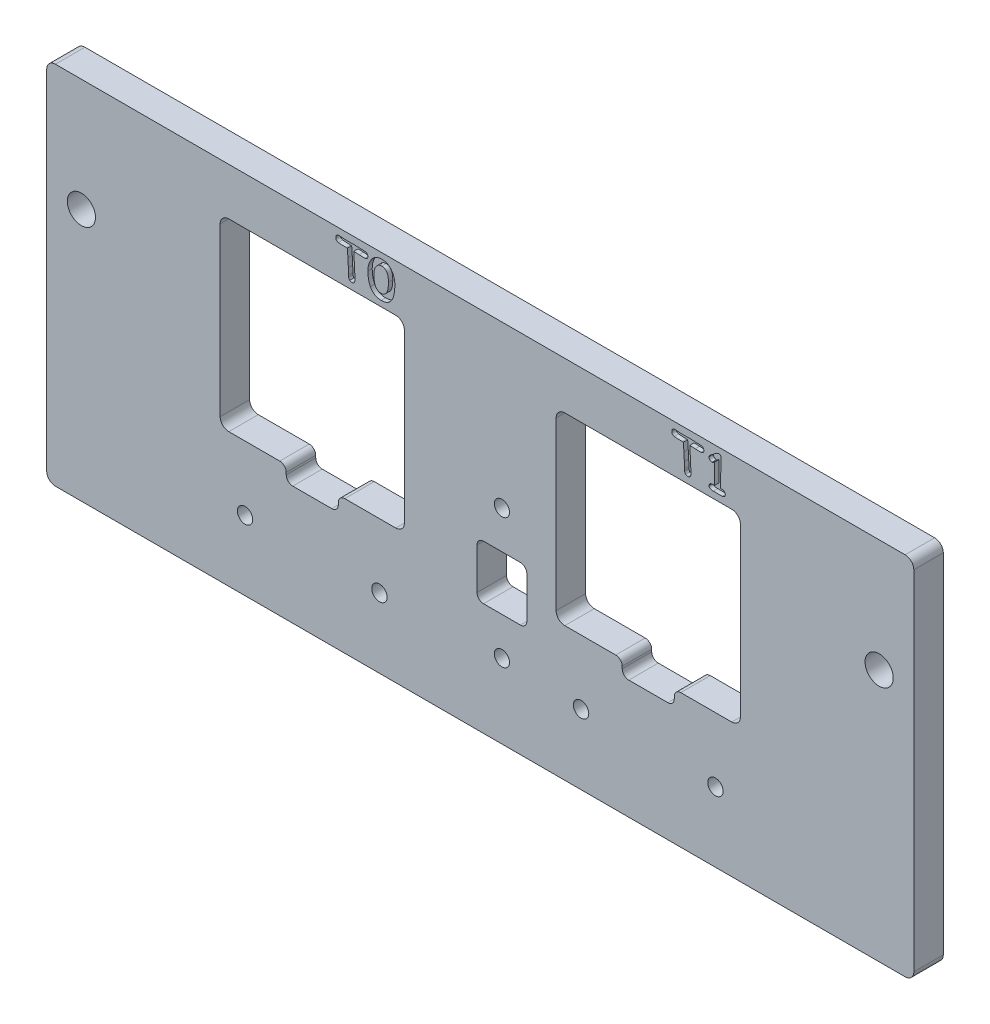
from build123d import *

# Parameters (mm, degrees)
SKETCH1_W            = 200
SKETCH1_H            = 84.3
BOSS_EXTRUDE1_DEPTH  = 6.8
SKETCH2_R            = 3.25
CUT_EXTRUDE1_DEPTH   = 6.8
FILLET1_R            = 2
SKETCH3_R            = 1.775
SKETCH3_W            = 42.5
SKETCH3_H            = 42.5
CUT_EXTRUDE2_DEPTH   = 109.732987175
FILLET2_R            = 2
SKETCH4_W            = 12
SKETCH4_H            = 7
CUT_EXTRUDE3_DEPTH   = 109.732987175
FILLET3_R            = 1.5
SKETCH5_R            = 1.75
SKETCH5_W            = 11.5
SKETCH5_H            = 12.5
CUT_EXTRUDE4_DEPTH   = 109.732987175
FILLET4_R            = 1.5
FILLET2_OF_MIRROR2_R = 2
FILLET3_OF_MIRROR2_R = 1.5
CUT_EXTRUDE5_DEPTH   = 1
SKETCH7_W            = 21.28068279
SKETCH7_H            = 41.252585481
BOSS_EXTRUDE2_DEPTH  = 6.8
SKETCH8_R            = 1.75
SKETCH8_W            = 11.5
SKETCH8_H            = 12.5
CUT_EXTRUDE6_DEPTH   = 109.732987306
FILLET5_R            = 1.5


with BuildPart() as part:
    # Sketch1 → Boss-Extrude1 (new body)
    with BuildSketch(Plane.XY):
        Rectangle(SKETCH1_W, SKETCH1_H)
    extrude(amount=BOSS_EXTRUDE1_DEPTH)

    # Sketch2 → Cut-Extrude1 (cut)
    with BuildSketch(Plane.XY.offset(6.8)):
        with Locations((-92, 16.15)):
            Circle(SKETCH2_R)
        with Locations((92, 16.15)):
            Circle(SKETCH2_R)
    extrude(amount=-CUT_EXTRUDE1_DEPTH, mode=Mode.SUBTRACT)

    # Fillet1
    fillet1_edges = [part.edges().sort_by_distance(p)[0] for p in [
        (-100, 42.15, 3.4),
        (100, 42.15, 3.4),
        (100, -42.15, 3.4),
        (-100, -42.15, 3.4),
    ]]
    fillet(fillet1_edges, radius=FILLET1_R)

    # Sketch3 → Cut-Extrude2 (cut, through all)
    with BuildSketch(Plane.XY.offset(6.8)):
        with Locations((23.25, -26.082)):
            Circle(SKETCH3_R)
        with Locations((54.25, -26.082)):
            Circle(SKETCH3_R)
        with Locations((38.75, 10)):
            Rectangle(SKETCH3_W, SKETCH3_H)
    cut_extrude2 = extrude(amount=-CUT_EXTRUDE2_DEPTH, mode=Mode.SUBTRACT)

    # Fillet2
    fillet2_edges = [part.edges().sort_by_distance(p)[0] for p in [
        (17.5, -11.25, 3.4),
        (17.5, 31.25, 3.4),
        (60, 31.25, 3.4),
        (60, -11.25, 3.4),
    ]]
    fillet(fillet2_edges, radius=FILLET2_R)

    # Sketch4 → Cut-Extrude3 (cut, through all)
    with BuildSketch(Plane.XY.offset(6.8)):
        with Locations((38.75, -11.25)):
            Rectangle(SKETCH4_W, SKETCH4_H)
    cut_extrude3 = extrude(amount=-CUT_EXTRUDE3_DEPTH, mode=Mode.SUBTRACT)

    # Fillet3
    fillet3_edges = [part.edges().sort_by_distance(p)[0] for p in [
        (44.75, -11.25, 3.4),
        (32.75, -11.25, 3.4),
        (32.75, -14.75, 3.4),
        (44.75, -14.75, 3.4),
    ]]
    fillet(fillet3_edges, radius=FILLET3_R)

    # Sketch5 → Cut-Extrude4 (cut, through all)
    with BuildSketch(Plane.XY.offset(6.8)):
        with Locations((0, -25)):
            Circle(SKETCH5_R)
        with Locations((0, 5)):
            Circle(SKETCH5_R)
        with Locations((0, -10)):
            Rectangle(SKETCH5_W, SKETCH5_H)
    extrude(amount=-CUT_EXTRUDE4_DEPTH, mode=Mode.SUBTRACT)

    # Fillet4
    fillet4_edges = [part.edges().sort_by_distance(p)[0] for p in [
        (-5.75, -16.25, 3.4),
        (-5.75, -3.75, 3.4),
        (5.75, -3.75, 3.4),
        (5.75, -16.25, 3.4),
    ]]
    fillet(fillet4_edges, radius=FILLET4_R)

    # Mirror2: Cut-Extrude2, Cut-Extrude3 across plane
    add(cut_extrude2.mirror(Plane(origin=(0, 0, 0), x_dir=(0, 0, 1), z_dir=(1, 0, 0))), mode=Mode.SUBTRACT)
    add(cut_extrude3.mirror(Plane(origin=(0, 0, 0), x_dir=(0, 0, 1), z_dir=(1, 0, 0))), mode=Mode.SUBTRACT)

    # Fillet2 of Mirror2
    fillet2_of_mirror2_edges = [part.edges().sort_by_distance(p)[0] for p in [
        (-17.5, -11.25, 3.4),
        (-17.5, 31.25, 3.4),
        (-60, 31.25, 3.4),
        (-60, -11.25, 3.4),
    ]]
    fillet(fillet2_of_mirror2_edges, radius=FILLET2_OF_MIRROR2_R)

    # Fillet3 of Mirror2
    fillet3_of_mirror2_edges = [part.edges().sort_by_distance(p)[0] for p in [
        (-44.75, -11.25, 3.4),
        (-32.75, -11.25, 3.4),
        (-32.75, -14.75, 3.4),
        (-44.75, -14.75, 3.4),
    ]]
    fillet(fillet3_of_mirror2_edges, radius=FILLET3_OF_MIRROR2_R)

    # Sketch6 → Cut-Extrude5 (cut)
    # profile 1 of 4: a face of its own
    with BuildSketch(Plane.XY.offset(6.8)):
        with BuildLine():
            add(Edge.make_bspline(
                [(-22.854938272, 32.552469136), (-22.925440154, 32.553769876), (-23.064077279, 32.556327692), (-23.268278968, 32.573067743), (-23.46497967, 32.603007744), (-23.654529595, 32.642101733), (-23.836539041, 32.695120248), (-24.011012016, 32.760393573), (-24.179055086, 32.835245321), (-24.339321197, 32.922720746), (-24.492298826, 33.020719631), (-24.635973837, 33.133344497), (-24.774113024, 33.255471714), (-24.905013479, 33.38922135), (-25.027503725, 33.535802351), (-25.142876706, 33.693027698), (-25.251950978, 33.861643079), (-25.31614447, 33.981008962), (-25.348765432, 34.041666667)],
                knots=[0, 0, 0, 0, 1.101036621, 2.165113118, 3.196701619, 4.206636599, 5.185419256, 6.153861669, 7.113904655, 8.055726016, 9.002740657, 9.947572133, 10.903573382, 11.880673289, 12.867074579, 13.884141148, 14.924792093, 16, 16, 16, 16], degree=3))
            add(Edge.make_bspline(
                [(-25.348765432, 34.041666667), (-25.395092563, 34.136135913), (-25.489399442, 34.328444386), (-25.603684257, 34.635727564), (-25.701033587, 34.962709817), (-25.780164989, 35.309285933), (-25.844142919, 35.675395463), (-25.888000382, 36.061356714), (-25.914341312, 36.467736668), (-25.917921481, 36.745329751), (-25.919753086, 36.887345679)],
                knots=[0, 0, 0, 0, 0.86163265, 1.754002121, 2.682094637, 3.655395029, 4.66495959, 5.72569639, 6.83647195, 8, 8, 8, 8], degree=3))
            add(Edge.make_bspline(
                [(-25.919753086, 36.887345679), (-25.91733714, 37.009859951), (-25.912576134, 37.251293713), (-25.876231036, 37.607114329), (-25.817472195, 37.951522689), (-25.736473684, 38.285171264), (-25.629468711, 38.606968199), (-25.499002624, 38.916754193), (-25.346917365, 39.216228577), (-25.226864821, 39.405229128), (-25.166666667, 39.5)],
                knots=[0, 0, 0, 0, 1.065446396, 2.099630748, 3.107335507, 4.102416534, 5.082906438, 6.053454268, 7.02394022, 8, 8, 8, 8], degree=3))
            add(Edge.make_bspline(
                [(-25.166666667, 39.5), (-25.128652907, 39.554937161), (-25.053742002, 39.663197761), (-24.932974367, 39.816514693), (-24.806417757, 39.958468011), (-24.674599175, 40.089899966), (-24.538967613, 40.212537546), (-24.397367191, 40.323743437), (-24.248859451, 40.422609377), (-24.097706527, 40.513739815), (-23.940381708, 40.593192875), (-23.777574247, 40.660662202), (-23.610067645, 40.720141193), (-23.436260126, 40.765343709), (-23.258270693, 40.803448865), (-23.074593471, 40.828434332), (-22.886182688, 40.847055956), (-22.75879311, 40.84819172), (-22.694444444, 40.848765432)],
                knots=[0, 0, 0, 0, 1.089001194, 2.146014127, 3.179577203, 4.187716666, 5.179502559, 6.159265929, 7.119926927, 8.086463806, 9.035375073, 9.990160863, 10.958261042, 11.930674461, 12.915914311, 13.924053774, 14.951371286, 16, 16, 16, 16], degree=3))
            add(Edge.make_bspline(
                [(-22.694444444, 40.848765432), (-22.57382937, 40.845527543), (-22.337866172, 40.839193155), (-21.994946982, 40.780313678), (-21.672753766, 40.68674769), (-21.372013922, 40.554111414), (-21.091347046, 40.384645249), (-20.832931231, 40.175703215), (-20.593394645, 39.930613046), (-20.458047143, 39.742648714), (-20.388888889, 39.646604938)],
                knots=[0, 0, 0, 0, 1.065421073, 2.084317927, 3.065587267, 4.024520138, 4.981370049, 5.954971245, 6.955055573, 8, 8, 8, 8], degree=3))
            add(Edge.make_bspline(
                [(-20.388888889, 39.646604938), (-20.333377065, 39.560556402), (-20.222336592, 39.388433249), (-20.082233292, 39.113239132), (-19.963264272, 38.825762117), (-19.865725213, 38.524944367), (-19.7901567, 38.210701719), (-19.736773943, 37.883158566), (-19.70347873, 37.542871434), (-19.699534294, 37.311805699), (-19.697530864, 37.194444444)],
                knots=[0, 0, 0, 0, 0.949659157, 1.899606148, 2.860462492, 3.834038165, 4.83079677, 5.856383007, 6.911229405, 8, 8, 8, 8], degree=3))
            add(Edge.make_bspline(
                [(-19.697530864, 37.194444444), (-19.699751223, 37.007137489), (-19.704056286, 36.643967313), (-19.74135279, 36.117472678), (-19.802109735, 35.626824377), (-19.887519223, 35.172357555), (-19.998204442, 34.753764699), (-20.133033734, 34.371087604), (-20.293818059, 34.024550006), (-20.478589847, 33.713530179), (-20.690095164, 33.440032007), (-20.924021672, 33.200339524), (-21.186182934, 33.00020194), (-21.472148488, 32.834822577), (-21.783626733, 32.70857979), (-22.118594446, 32.616982322), (-22.478690976, 32.56279871), (-22.727178711, 32.555976674), (-22.854938272, 32.552469136)],
                knots=[0, 0, 0, 0, 1.410768719, 2.735344897, 3.97339736, 5.133070797, 6.215826799, 7.231830758, 8.185260544, 9.089012029, 9.950857309, 10.783804673, 11.604540534, 12.427350082, 13.264917127, 14.128798245, 15.03792469, 16, 16, 16, 16], degree=3))
        make_face()
        with BuildLine():
            add(Edge.make_bspline(
                [(-22.733024691, 39.466049383), (-22.801655873, 39.464028791), (-22.937060665, 39.460042296), (-23.134218878, 39.417837976), (-23.321066962, 39.352923711), (-23.498132157, 39.262854581), (-23.662069292, 39.143152057), (-23.817465655, 39.000314298), (-23.962132736, 38.830864786), (-24.045152532, 38.703185474), (-24.087962963, 38.637345679)],
                knots=[0, 0, 0, 0, 0.987720428, 1.948707218, 2.891188167, 3.832764918, 4.799652197, 5.806957348, 6.869123932, 8, 8, 8, 8], degree=3))
            add(Edge.make_bspline(
                [(-24.087962963, 38.637345679), (-24.123938182, 38.57667067), (-24.195957498, 38.455204483), (-24.286078045, 38.263177928), (-24.363962072, 38.064868499), (-24.42722267, 37.858993268), (-24.476284, 37.64595771), (-24.512355182, 37.425931676), (-24.531893972, 37.19840024), (-24.535305572, 37.044272649), (-24.537037037, 36.966049383)],
                knots=[0, 0, 0, 0, 0.965078813, 1.932005355, 2.899623887, 3.879614671, 4.877106227, 5.890011682, 6.929132817, 8, 8, 8, 8], degree=3))
            add(Edge.make_bspline(
                [(-24.537037037, 36.966049383), (-24.536789043, 36.864179937), (-24.536307882, 36.666531362), (-24.522787104, 36.379441994), (-24.5052284, 36.110719452), (-24.479260286, 35.859964308), (-24.444848343, 35.626924871), (-24.406465094, 35.411104115), (-24.356739711, 35.21397891), (-24.316973433, 35.09034962), (-24.297839506, 35.030864198)],
                knots=[0, 0, 0, 0, 1.24838878, 2.422141985, 3.521760686, 4.548725799, 5.510782421, 6.408528782, 7.23424831, 8, 8, 8, 8], degree=3))
            add(Edge.make_bspline(
                [(-24.297839506, 35.030864198), (-24.264450364, 34.944532951), (-24.200121713, 34.778204252), (-24.073173337, 34.552764898), (-23.926033183, 34.361763115), (-23.757913148, 34.205201396), (-23.56918874, 34.083720388), (-23.36013747, 33.995602853), (-23.130546124, 33.944346213), (-22.970937912, 33.938295596), (-22.888888889, 33.935185185)],
                knots=[0, 0, 0, 0, 1.155090394, 2.225436224, 3.218966621, 4.155622191, 5.080634948, 6.007876656, 6.975918764, 8, 8, 8, 8], degree=3))
            add(Edge.make_bspline(
                [(-22.888888889, 33.935185185), (-22.819807015, 33.937580916), (-22.68481157, 33.942262501), (-22.488905797, 33.978104722), (-22.306266018, 34.038307019), (-22.138014477, 34.124211821), (-21.983719037, 34.233935648), (-21.841756839, 34.366143939), (-21.714991594, 34.52440873), (-21.600453044, 34.70600757), (-21.500710166, 34.912369071), (-21.415026856, 35.142109708), (-21.340462687, 35.395136519), (-21.281564392, 35.672315067), (-21.235640126, 35.973813596), (-21.202124065, 36.298753595), (-21.181949664, 36.647890127), (-21.180011712, 36.888346626), (-21.179012346, 37.012345679)],
                knots=[0, 0, 0, 0, 0.839850773, 1.641183446, 2.412778331, 3.171043049, 3.929617431, 4.708684097, 5.522617875, 6.388740024, 7.314899046, 8.304914321, 9.368005926, 10.520288666, 11.748457435, 13.075714715, 14.491999149, 16, 16, 16, 16], degree=3))
            add(Edge.make_bspline(
                [(-21.179012346, 37.012345679), (-21.180048742, 37.111664398), (-21.182053663, 37.303797657), (-21.201622241, 37.582282779), (-21.229069495, 37.842296572), (-21.273133237, 38.082666501), (-21.325322527, 38.304712066), (-21.394305811, 38.50594126), (-21.471842648, 38.689118137), (-21.563363435, 38.852767998), (-21.667311525, 38.996809927), (-21.781482829, 39.12433722), (-21.911203227, 39.229028005), (-22.051252339, 39.317686317), (-22.205396821, 39.383244325), (-22.370602905, 39.431278926), (-22.547764407, 39.461541847), (-22.670142996, 39.464519419), (-22.733024691, 39.466049383)],
                knots=[0, 0, 0, 0, 1.451310721, 2.807578068, 4.078675786, 5.270246053, 6.377072111, 7.408892681, 8.375345316, 9.280835355, 10.142571817, 10.967410406, 11.774095613, 12.57101741, 13.382488036, 14.212790549, 15.081679558, 16, 16, 16, 16], degree=3))
        make_face(mode=Mode.SUBTRACT)
    # profile 2 of 4: a face of its own
    with BuildSketch(Plane.XY.offset(6.8)):
        with BuildLine():
            add(Edge.make_bspline(
                [(-26.652777778, 39.070987654), (-26.688784827, 39.071562803), (-26.765941805, 39.072795248), (-26.888412289, 39.07342316), (-27.0252248, 39.078821613), (-27.175904651, 39.085371362), (-27.341117879, 39.090534829), (-27.520074965, 39.100614703), (-27.712988044, 39.111181347), (-27.846197289, 39.119270986), (-27.915123457, 39.12345679)],
                knots=[0, 0, 0, 0, 0.683988828, 1.465671655, 2.325955068, 3.284238971, 4.330388314, 5.465254938, 6.68845242, 8, 8, 8, 8], degree=3))
            add(Edge.make_bspline(
                [(-27.915123457, 39.12345679), (-27.981981468, 39.127837243), (-28.111540374, 39.13632578), (-28.299934775, 39.144314362), (-28.476263177, 39.154915523), (-28.640420628, 39.160364917), (-28.792677015, 39.165285956), (-28.932087747, 39.168301791), (-29.059666233, 39.170065536), (-29.140431642, 39.169854091), (-29.179012346, 39.169753086)],
                knots=[0, 0, 0, 0, 1.271157159, 2.463275933, 3.577418203, 4.622432292, 5.579327957, 6.467672363, 7.268024779, 8, 8, 8, 8], degree=3))
            add(Edge.make_bspline(
                [(-29.179012346, 39.169753086), (-29.177099985, 39.115219987), (-29.17293149, 38.996350739), (-29.162829405, 38.804024116), (-29.153138382, 38.582199645), (-29.136258326, 38.331823971), (-29.120660305, 38.051835763), (-29.097602279, 37.743356291), (-29.07533274, 37.405298223), (-29.058269771, 37.170257712), (-29.049382716, 37.047839506)],
                knots=[0, 0, 0, 0, 0.615983597, 1.34269844, 2.174098459, 3.122424446, 4.175436635, 5.339685182, 6.614404959, 8, 8, 8, 8], degree=3))
            add(Edge.make_bspline(
                [(-29.049382716, 37.047839506), (-29.041480859, 36.938283956), (-29.026125199, 36.725384937), (-29.006795203, 36.41460337), (-28.987072854, 36.121520934), (-28.973825364, 35.84572236), (-28.962714951, 35.587496412), (-28.955046374, 35.347256248), (-28.950063266, 35.12450681), (-28.949394937, 34.981998231), (-28.949074074, 34.913580247)],
                knots=[0, 0, 0, 0, 1.233537667, 2.397130592, 3.496937971, 4.532318174, 5.497915878, 6.399582772, 7.231644004, 8, 8, 8, 8], degree=3))
            add(Edge.make_bspline(
                [(-28.949074074, 34.913580247), (-28.948788382, 34.880652279), (-28.948149631, 34.807031749), (-28.941457873, 34.68609812), (-28.929913499, 34.543180567), (-28.91735182, 34.386210155), (-28.901058607, 34.229055962), (-28.890610083, 34.086514356), (-28.8835471, 33.965092961), (-28.882975636, 33.891468531), (-28.882716049, 33.858024691)],
                knots=[0, 0, 0, 0, 0.746885903, 1.669891549, 2.74651193, 3.999468259, 5.241838954, 6.330094733, 7.241446832, 8, 8, 8, 8], degree=3))
            add(Edge.make_bspline(
                [(-28.882716049, 33.858024691), (-28.883811268, 33.794185224), (-28.885944759, 33.669825618), (-28.905143006, 33.488321964), (-28.934819425, 33.316172507), (-28.966121493, 33.206563259), (-28.981481481, 33.152777778)],
                knots=[0, 0, 0, 0, 1.071519312, 2.087325055, 3.061446493, 4, 4, 4, 4], degree=3))
            add(Edge.make_bspline(
                [(-28.981481481, 33.152777778), (-28.999785269, 33.120932894), (-29.035280218, 33.059178869), (-29.099111883, 32.97669912), (-29.168875001, 32.907107316), (-29.243130561, 32.848304001), (-29.325268531, 32.805351113), (-29.411915925, 32.771882933), (-29.505411753, 32.753552236), (-29.569372674, 32.751196325), (-29.601851852, 32.75)],
                knots=[0, 0, 0, 0, 1.128464981, 2.188334412, 3.194933904, 4.153538837, 5.087690591, 6.033685209, 7.001510831, 8, 8, 8, 8], degree=3))
            add(Edge.make_bspline(
                [(-29.601851852, 32.75), (-29.648891101, 32.751866242), (-29.741681393, 32.755547618), (-29.876379992, 32.791314201), (-30.003283508, 32.848068703), (-30.078026744, 32.902892516), (-30.115740741, 32.930555556)],
                knots=[0, 0, 0, 0, 1.014701212, 2.001614024, 2.991652953, 4, 4, 4, 4], degree=3))
            add(Edge.make_bspline(
                [(-30.115740741, 32.930555556), (-30.1533762, 32.96510019), (-30.22644149, 33.032164969), (-30.307015163, 33.155405129), (-30.355874342, 33.292243812), (-30.361388987, 33.387974089), (-30.364197531, 33.436728395)],
                knots=[0, 0, 0, 0, 1.048117124, 2.034809312, 2.999151463, 4, 4, 4, 4], degree=3))
            add(Edge.make_bspline(
                [(-30.364197531, 33.436728395), (-30.364197531, 33.467078189), (-30.364197531, 33.540123457), (-30.364197531, 33.656893004), (-30.364197531, 33.774691358), (-30.364197531, 33.849794239), (-30.364197531, 33.88117284)],
                knots=[0, 0, 0, 0, 0.819444444, 1.972222222, 3.152777778, 4, 4, 4, 4], degree=3))
            add(Edge.make_bspline(
                [(-30.364197531, 33.88117284), (-30.364446074, 33.925932255), (-30.364997634, 34.025261341), (-30.372403572, 34.189328976), (-30.380993738, 34.383837184), (-30.395055765, 34.598765727), (-30.409185559, 34.814205328), (-30.41772093, 35.009745393), (-30.425153263, 35.175870355), (-30.425684696, 35.276742539), (-30.425925926, 35.322530864)],
                knots=[0, 0, 0, 0, 0.744434001, 1.65203115, 2.731327345, 3.982896076, 5.234464807, 6.322307542, 7.238454809, 8, 8, 8, 8], degree=3))
            add(Edge.make_bspline(
                [(-30.425925926, 35.322530864), (-30.426248818, 35.382718659), (-30.426922285, 35.508254343), (-30.43187751, 35.704257487), (-30.439594348, 35.915690976), (-30.450587937, 36.142029649), (-30.464029189, 36.383877228), (-30.483584398, 36.640430006), (-30.503022231, 36.913149466), (-30.518341145, 37.099807706), (-30.526234568, 37.195987654)],
                knots=[0, 0, 0, 0, 0.769722187, 1.605435146, 2.507300893, 3.475448232, 4.503413479, 5.604869268, 6.765853841, 8, 8, 8, 8], degree=3))
            add(Edge.make_bspline(
                [(-30.526234568, 37.195987654), (-30.535514161, 37.30452457), (-30.553367361, 37.513340972), (-30.57867343, 37.813154517), (-30.597861909, 38.087477807), (-30.616875641, 38.334831088), (-30.632331594, 38.556027149), (-30.644810049, 38.750981612), (-30.654254416, 38.919706561), (-30.658541754, 39.023657577), (-30.660493827, 39.070987654)],
                knots=[0, 0, 0, 0, 1.390685658, 2.675568704, 3.841071853, 4.901303653, 5.842688727, 6.6718063, 7.39525834, 8, 8, 8, 8], degree=3))
            Line((-30.660493827, 39.070987654), (-30.929012346, 39.070987654))
            add(Edge.make_bspline(
                [(-30.929012346, 39.070987654), (-31.022121409, 39.07126726), (-31.203721911, 39.071812603), (-31.469175674, 39.076527228), (-31.719721501, 39.084021431), (-31.955349131, 39.094808767), (-32.176074521, 39.108550723), (-32.382397039, 39.12541467), (-32.573881656, 39.144948837), (-32.69602769, 39.161711076), (-32.75462963, 39.169753086)],
                knots=[0, 0, 0, 0, 1.221276735, 2.381985805, 3.482310128, 4.508984017, 5.475754441, 6.382931502, 7.224179888, 8, 8, 8, 8], degree=3))
            add(Edge.make_bspline(
                [(-32.75462963, 39.169753086), (-32.799847259, 39.183408101), (-32.886300517, 39.209515627), (-33.004231371, 39.267430608), (-33.104273592, 39.338500551), (-33.186575921, 39.423698369), (-33.251034753, 39.522456767), (-33.295874258, 39.635779702), (-33.321935902, 39.762195058), (-33.325376038, 39.850697333), (-33.327160494, 39.896604938)],
                knots=[0, 0, 0, 0, 1.122004123, 2.145201149, 3.109501176, 4.026702373, 4.946348357, 5.896023303, 6.908632205, 8, 8, 8, 8], degree=3))
            add(Edge.make_bspline(
                [(-33.327160494, 39.896604938), (-33.324590998, 39.942595585), (-33.319496803, 40.03377506), (-33.284398068, 40.167298024), (-33.225566051, 40.2941643), (-33.169138973, 40.369222223), (-33.140432099, 40.407407407)],
                knots=[0, 0, 0, 0, 0.994849864, 1.972355134, 2.968450117, 4, 4, 4, 4], degree=3))
            add(Edge.make_bspline(
                [(-33.140432099, 40.407407407), (-33.103346876, 40.448879912), (-33.031465376, 40.529265186), (-32.890688646, 40.60906609), (-32.734982026, 40.655732024), (-32.625851314, 40.652767075), (-32.569444444, 40.651234568)],
                knots=[0, 0, 0, 0, 1.025355894, 1.987425554, 2.959751808, 4, 4, 4, 4], degree=3))
            add(Edge.make_bspline(
                [(-32.569444444, 40.651234568), (-32.551952754, 40.65023767), (-32.511811355, 40.647949904), (-32.444425665, 40.643259465), (-32.362637188, 40.637052227), (-32.266956389, 40.629339503), (-32.156895247, 40.619840999), (-32.032297737, 40.609713194), (-31.893101884, 40.594647168), (-31.795286161, 40.586222292), (-31.74382716, 40.581790123)],
                knots=[0, 0, 0, 0, 0.507467934, 1.164579958, 1.95651368, 2.883298637, 3.944953106, 5.156332943, 6.504000604, 8, 8, 8, 8], degree=3))
            add(Edge.make_bspline(
                [(-31.74382716, 40.581790123), (-31.662061976, 40.574282706), (-31.507375076, 40.560079851), (-31.287177506, 40.544562428), (-31.092170886, 40.534576885), (-30.970174318, 40.533094899), (-30.913580247, 40.532407407)],
                knots=[0, 0, 0, 0, 1.184249789, 2.240414763, 3.183730386, 4, 4, 4, 4], degree=3))
            add(Edge.make_bspline(
                [(-30.913580247, 40.532407407), (-30.854422059, 40.532168556), (-30.722723491, 40.531636821), (-30.505674169, 40.536614242), (-30.248950887, 40.536138174), (-29.966051127, 40.541859657), (-29.683136728, 40.546475577), (-29.426433534, 40.548736966), (-29.209374489, 40.553152758), (-29.077676463, 40.552681032), (-29.018518519, 40.552469136)],
                knots=[0, 0, 0, 0, 0.749130581, 1.667722211, 2.749095541, 3.99997057, 5.250845599, 6.332277789, 7.250869419, 8, 8, 8, 8], degree=3))
            add(Edge.make_bspline(
                [(-29.018518519, 40.552469136), (-28.983535453, 40.552720182), (-28.909440132, 40.553251906), (-28.792195784, 40.54874414), (-28.662490229, 40.547114944), (-28.520607738, 40.539331274), (-28.366683073, 40.534740934), (-28.200665942, 40.523765521), (-28.022018006, 40.516165631), (-27.834955014, 40.502276613), (-27.647584605, 40.493150972), (-27.469224267, 40.48084065), (-27.302947743, 40.47453384), (-27.149250292, 40.4652813), (-27.007178492, 40.462130885), (-26.877617135, 40.456007146), (-26.760282193, 40.455522922), (-26.686212379, 40.454287231), (-26.651234568, 40.453703704)],
                knots=[0, 0, 0, 0, 0.70853424, 1.500699603, 2.376195833, 3.335706607, 4.378501961, 5.495152885, 6.705444699, 8.000163868, 9.294253972, 10.505128724, 11.621244772, 12.664508529, 13.623623198, 14.499429393, 15.291389149, 16, 16, 16, 16], degree=3))
            add(Edge.make_bspline(
                [(-26.651234568, 40.453703704), (-26.601115031, 40.451439045), (-26.503528025, 40.447029561), (-26.363379691, 40.409497237), (-26.237799333, 40.344271568), (-26.127128355, 40.257856163), (-26.03366225, 40.154442989), (-25.968588579, 40.033997209), (-25.925507901, 39.90362245), (-25.921695564, 39.812076808), (-25.919753086, 39.765432099)],
                knots=[0, 0, 0, 0, 1.073285723, 2.089778725, 3.081076514, 4.086926576, 5.08695682, 6.044497551, 7.003624404, 8, 8, 8, 8], degree=3))
            add(Edge.make_bspline(
                [(-25.919753086, 39.765432099), (-25.922485382, 39.718341177), (-25.927807727, 39.626610921), (-25.968056837, 39.494233146), (-26.035536486, 39.373820636), (-26.128558777, 39.268624324), (-26.238440284, 39.179851035), (-26.365679753, 39.11763035), (-26.504720672, 39.077019022), (-26.602585731, 39.073032316), (-26.652777778, 39.070987654)],
                knots=[0, 0, 0, 0, 1.003766424, 1.955276033, 2.923356711, 3.927063114, 4.935081916, 5.916880896, 6.931630819, 8, 8, 8, 8], degree=3))
        make_face()
    # profile 3 of 4: a face of its own
    with BuildSketch(Plane.XY.offset(6.8)):
        with BuildLine():
            Line((55.807098765, 32.75), (53.74691358, 32.75))
            add(Edge.make_bspline(
                [(53.74691358, 32.75), (53.670129907, 32.751275343), (53.526206319, 32.753665849), (53.325615709, 32.783907261), (53.153770069, 32.827134348), (53.012106462, 32.894113127), (52.900700839, 32.980857055), (52.821414695, 33.08924929), (52.773128896, 33.216866843), (52.768065051, 33.308721538), (52.765432099, 33.356481481)],
                knots=[0, 0, 0, 0, 1.415135186, 2.652534404, 3.734544985, 4.672554218, 5.523260805, 6.310976397, 7.121790439, 8, 8, 8, 8], degree=3))
            add(Edge.make_bspline(
                [(52.765432099, 33.356481481), (52.768384418, 33.410412386), (52.774006694, 33.513116212), (52.825485276, 33.656982631), (52.912200956, 33.777640222), (53.03173293, 33.877434984), (53.185936398, 33.950448952), (53.37124509, 34.001446255), (53.588413266, 34.033523052), (53.7442179, 34.036823339), (53.827160494, 34.038580247)],
                knots=[0, 0, 0, 0, 0.905373615, 1.724156773, 2.531277661, 3.379243946, 4.316186145, 5.379299071, 6.604869919, 8, 8, 8, 8], degree=3))
            add(Edge.make_bspline(
                [(53.827160494, 34.038580247), (53.86265645, 34.038169297), (53.93674463, 34.037311551), (54.010804986, 34.035101713), (54.049382716, 34.033950617)],
                knots=[0, 0, 0, 0, 0.958208341, 2, 2, 2, 2], degree=3))
            Line((54.049382716, 34.033950617), (54.049382716, 38.691358025))
            add(Edge.make_bspline(
                [(54.049382716, 38.691358025), (54.013958943, 38.66707333), (53.946996414, 38.621167306), (53.85094844, 38.557690348), (53.765288696, 38.502725202), (53.687288007, 38.460933765), (53.622182871, 38.423000809), (53.56377949, 38.401151991), (53.516498174, 38.38294864), (53.486739757, 38.380637333), (53.473765432, 38.37962963)],
                knots=[0, 0, 0, 0, 1.561944787, 2.952587071, 4.188085884, 5.260224314, 6.172561158, 6.919514454, 7.528920812, 8, 8, 8, 8], degree=3))
            add(Edge.make_bspline(
                [(53.473765432, 38.37962963), (53.427721333, 38.381852237), (53.33651812, 38.386254732), (53.204736189, 38.426154852), (53.083761745, 38.493489835), (52.973853871, 38.581575756), (52.882624743, 38.688092958), (52.813980509, 38.805291768), (52.773954861, 38.932148126), (52.768291529, 39.01927901), (52.765432099, 39.063271605)],
                knots=[0, 0, 0, 0, 1.013852114, 2.008217582, 3.003359493, 4.052344806, 5.098380764, 6.079255836, 7.0302116, 8, 8, 8, 8], degree=3))
            add(Edge.make_bspline(
                [(52.765432099, 39.063271605), (52.769846993, 39.11182063), (52.779052149, 39.213046472), (52.85201304, 39.360365906), (52.961764782, 39.508505441), (53.058895345, 39.597317728), (53.111111111, 39.645061728)],
                knots=[0, 0, 0, 0, 0.833605739, 1.738087287, 2.784033566, 4, 4, 4, 4], degree=3))
            Line((53.111111111, 39.645061728), (53.692901235, 40.066358025))
            Line((53.692901235, 40.066358025), (54.320987654, 40.570987654))
            add(Edge.make_bspline(
                [(54.320987654, 40.570987654), (54.383649889, 40.613592492), (54.503523917, 40.695096345), (54.694363408, 40.781570577), (54.881461714, 40.838774223), (55.006821937, 40.84549222), (55.067901235, 40.848765432)],
                knots=[0, 0, 0, 0, 1.121272833, 2.145015919, 3.096195581, 4, 4, 4, 4], degree=3))
            add(Edge.make_bspline(
                [(55.067901235, 40.848765432), (55.104095899, 40.84709234), (55.17291396, 40.843911236), (55.269242197, 40.81721913), (55.351896542, 40.773911833), (55.419239549, 40.710958418), (55.470657456, 40.630259601), (55.505342863, 40.532106825), (55.526946624, 40.417601102), (55.529500598, 40.335500966), (55.530864198, 40.291666667)],
                knots=[0, 0, 0, 0, 1.048007274, 1.992609376, 2.873587166, 3.728544433, 4.634673172, 5.621103599, 6.729877163, 8, 8, 8, 8], degree=3))
            add(Edge.make_bspline(
                [(55.530864198, 40.291666667), (55.531126669, 40.237651771), (55.531674154, 40.124983108), (55.527152627, 39.948055043), (55.525541865, 39.755616118), (55.517772155, 39.547345501), (55.513132259, 39.323500057), (55.502215591, 39.083879587), (55.494659209, 38.828628475), (55.480192629, 38.555629236), (55.470569349, 38.259777636), (55.458499363, 37.936794972), (55.452349187, 37.583842665), (55.443173982, 37.201168374), (55.440171029, 36.788060928), (55.434108863, 36.345179917), (55.433875067, 35.872940349), (55.432702634, 35.548353184), (55.432098765, 35.38117284)],
                knots=[0, 0, 0, 0, 0.527813644, 1.10095664, 1.72938664, 2.408302001, 3.137464797, 3.91720181, 4.752194944, 5.632803057, 6.588542385, 7.64475597, 8.791141156, 10.038040056, 11.38530595, 12.828075392, 14.366283368, 16, 16, 16, 16], degree=3))
            Line((55.432098765, 35.38117284), (55.432098765, 34.132716049))
            Line((55.432098765, 34.132716049), (55.785493827, 34.132716049))
            add(Edge.make_bspline(
                [(55.785493827, 34.132716049), (55.835639165, 34.130533814), (55.932779157, 34.126306455), (56.072553048, 34.087803916), (56.198629578, 34.023778796), (56.309745245, 33.936890522), (56.402606312, 33.832974971), (56.470554502, 33.713778629), (56.510564414, 33.581196878), (56.515810954, 33.488958952), (56.518518519, 33.441358025)],
                knots=[0, 0, 0, 0, 1.070033963, 2.072836576, 3.070927483, 4.073730096, 5.070730524, 6.030736016, 6.983728311, 8, 8, 8, 8], degree=3))
            add(Edge.make_bspline(
                [(56.518518519, 33.441358025), (56.516512529, 33.39371991), (56.512623581, 33.301365423), (56.471395802, 33.169023439), (56.406373511, 33.048952274), (56.316022836, 32.94447048), (56.208703928, 32.857671539), (56.085786664, 32.794933612), (55.950330445, 32.756491391), (55.855710701, 32.752203137), (55.807098765, 32.75)],
                knots=[0, 0, 0, 0, 1.030309817, 1.997428643, 2.975999118, 3.973155493, 4.973303344, 5.951301239, 6.947458459, 8, 8, 8, 8], degree=3))
        make_face()
    # profile 4 of 4: a face of its own
    with BuildSketch(Plane.XY.offset(6.8)):
        with BuildLine():
            add(Edge.make_bspline(
                [(50.847222222, 39.070987654), (50.811215173, 39.071562803), (50.734058195, 39.072795248), (50.611587711, 39.07342316), (50.4747752, 39.078821613), (50.324095349, 39.085371362), (50.158882121, 39.090534829), (49.979925035, 39.100614703), (49.787011956, 39.111181347), (49.653802711, 39.119270986), (49.584876543, 39.12345679)],
                knots=[0, 0, 0, 0, 0.683988828, 1.465671655, 2.325955068, 3.284238971, 4.330388314, 5.465254938, 6.68845242, 8, 8, 8, 8], degree=3))
            add(Edge.make_bspline(
                [(49.584876543, 39.12345679), (49.518018532, 39.127837243), (49.388459626, 39.13632578), (49.200065225, 39.144314362), (49.023736823, 39.154915523), (48.859579372, 39.160364917), (48.707322985, 39.165285956), (48.567912253, 39.168301791), (48.440333767, 39.170065536), (48.359568358, 39.169854091), (48.320987654, 39.169753086)],
                knots=[0, 0, 0, 0, 1.271157159, 2.463275933, 3.577418203, 4.622432292, 5.579327957, 6.467672363, 7.268024779, 8, 8, 8, 8], degree=3))
            add(Edge.make_bspline(
                [(48.320987654, 39.169753086), (48.322900015, 39.115219987), (48.32706851, 38.996350739), (48.337170595, 38.804024116), (48.346861618, 38.582199645), (48.363741674, 38.331823971), (48.379339695, 38.051835763), (48.402397721, 37.743356291), (48.42466726, 37.405298223), (48.441730229, 37.170257712), (48.450617284, 37.047839506)],
                knots=[0, 0, 0, 0, 0.615983597, 1.34269844, 2.174098459, 3.122424446, 4.175436635, 5.339685182, 6.614404959, 8, 8, 8, 8], degree=3))
            add(Edge.make_bspline(
                [(48.450617284, 37.047839506), (48.458519141, 36.938283956), (48.473874801, 36.725384937), (48.493204797, 36.41460337), (48.512927146, 36.121520934), (48.526174636, 35.84572236), (48.537285049, 35.587496412), (48.544953626, 35.347256248), (48.549936734, 35.12450681), (48.550605063, 34.981998231), (48.550925926, 34.913580247)],
                knots=[0, 0, 0, 0, 1.233537667, 2.397130592, 3.496937971, 4.532318174, 5.497915878, 6.399582772, 7.231644004, 8, 8, 8, 8], degree=3))
            add(Edge.make_bspline(
                [(48.550925926, 34.913580247), (48.551211618, 34.880652279), (48.551850369, 34.807031749), (48.558542127, 34.68609812), (48.570086501, 34.543180567), (48.58264818, 34.386210155), (48.598941393, 34.229055962), (48.609389917, 34.086514356), (48.6164529, 33.965092961), (48.617024364, 33.891468531), (48.617283951, 33.858024691)],
                knots=[0, 0, 0, 0, 0.746885903, 1.669891549, 2.74651193, 3.999468259, 5.241838954, 6.330094733, 7.241446832, 8, 8, 8, 8], degree=3))
            add(Edge.make_bspline(
                [(48.617283951, 33.858024691), (48.616188732, 33.794185224), (48.614055241, 33.669825618), (48.594856994, 33.488321964), (48.565180575, 33.316172507), (48.533878507, 33.206563259), (48.518518519, 33.152777778)],
                knots=[0, 0, 0, 0, 1.071519312, 2.087325055, 3.061446493, 4, 4, 4, 4], degree=3))
            add(Edge.make_bspline(
                [(48.518518519, 33.152777778), (48.500214731, 33.120932894), (48.464719782, 33.059178869), (48.400888117, 32.97669912), (48.331124999, 32.907107316), (48.256869439, 32.848304001), (48.174731469, 32.805351113), (48.088084075, 32.771882933), (47.994588247, 32.753552236), (47.930627326, 32.751196325), (47.898148148, 32.75)],
                knots=[0, 0, 0, 0, 1.128464981, 2.188334412, 3.194933904, 4.153538837, 5.087690591, 6.033685209, 7.001510831, 8, 8, 8, 8], degree=3))
            add(Edge.make_bspline(
                [(47.898148148, 32.75), (47.851108899, 32.751866242), (47.758318607, 32.755547618), (47.623620008, 32.791314201), (47.496716492, 32.848068703), (47.421973256, 32.902892516), (47.384259259, 32.930555556)],
                knots=[0, 0, 0, 0, 1.014701212, 2.001614024, 2.991652953, 4, 4, 4, 4], degree=3))
            add(Edge.make_bspline(
                [(47.384259259, 32.930555556), (47.3466238, 32.96510019), (47.27355851, 33.032164969), (47.192984837, 33.155405129), (47.144125658, 33.292243812), (47.138611013, 33.387974089), (47.135802469, 33.436728395)],
                knots=[0, 0, 0, 0, 1.048117124, 2.034809312, 2.999151463, 4, 4, 4, 4], degree=3))
            add(Edge.make_bspline(
                [(47.135802469, 33.436728395), (47.135802469, 33.467078189), (47.135802469, 33.540123457), (47.135802469, 33.656893004), (47.135802469, 33.774691358), (47.135802469, 33.849794239), (47.135802469, 33.88117284)],
                knots=[0, 0, 0, 0, 0.819444444, 1.972222222, 3.152777778, 4, 4, 4, 4], degree=3))
            add(Edge.make_bspline(
                [(47.135802469, 33.88117284), (47.135553926, 33.925932255), (47.135002366, 34.025261341), (47.127596428, 34.189328976), (47.119006262, 34.383837184), (47.104944235, 34.598765727), (47.090814441, 34.814205328), (47.08227907, 35.009745393), (47.074846737, 35.175870355), (47.074315304, 35.276742539), (47.074074074, 35.322530864)],
                knots=[0, 0, 0, 0, 0.744434001, 1.65203115, 2.731327345, 3.982896076, 5.234464807, 6.322307542, 7.238454809, 8, 8, 8, 8], degree=3))
            add(Edge.make_bspline(
                [(47.074074074, 35.322530864), (47.073751182, 35.382718659), (47.073077715, 35.508254343), (47.06812249, 35.704257487), (47.060405652, 35.915690976), (47.049412063, 36.142029649), (47.035970811, 36.383877228), (47.016415602, 36.640430006), (46.996977769, 36.913149466), (46.981658855, 37.099807706), (46.973765432, 37.195987654)],
                knots=[0, 0, 0, 0, 0.769722187, 1.605435146, 2.507300893, 3.475448232, 4.503413479, 5.604869268, 6.765853841, 8, 8, 8, 8], degree=3))
            add(Edge.make_bspline(
                [(46.973765432, 37.195987654), (46.964485839, 37.30452457), (46.946632639, 37.513340972), (46.92132657, 37.813154517), (46.902138091, 38.087477807), (46.883124359, 38.334831088), (46.867668406, 38.556027149), (46.855189951, 38.750981612), (46.845745584, 38.919706561), (46.841458246, 39.023657577), (46.839506173, 39.070987654)],
                knots=[0, 0, 0, 0, 1.390685658, 2.675568704, 3.841071853, 4.901303653, 5.842688727, 6.6718063, 7.39525834, 8, 8, 8, 8], degree=3))
            Line((46.839506173, 39.070987654), (46.570987654, 39.070987654))
            add(Edge.make_bspline(
                [(46.570987654, 39.070987654), (46.477878591, 39.07126726), (46.296278089, 39.071812603), (46.030824326, 39.076527228), (45.780278499, 39.084021431), (45.544650869, 39.094808767), (45.323925479, 39.108550723), (45.117602961, 39.12541467), (44.926118344, 39.144948837), (44.80397231, 39.161711076), (44.74537037, 39.169753086)],
                knots=[0, 0, 0, 0, 1.221276735, 2.381985805, 3.482310128, 4.508984017, 5.475754441, 6.382931502, 7.224179888, 8, 8, 8, 8], degree=3))
            add(Edge.make_bspline(
                [(44.74537037, 39.169753086), (44.700152741, 39.183408101), (44.613699483, 39.209515627), (44.495768629, 39.267430608), (44.395726408, 39.338500551), (44.313424079, 39.423698369), (44.248965247, 39.522456767), (44.204125742, 39.635779702), (44.178064098, 39.762195058), (44.174623962, 39.850697333), (44.172839506, 39.896604938)],
                knots=[0, 0, 0, 0, 1.122004123, 2.145201149, 3.109501176, 4.026702373, 4.946348357, 5.896023303, 6.908632205, 8, 8, 8, 8], degree=3))
            add(Edge.make_bspline(
                [(44.172839506, 39.896604938), (44.175409002, 39.942595585), (44.180503197, 40.03377506), (44.215601932, 40.167298024), (44.274433949, 40.2941643), (44.330861027, 40.369222223), (44.359567901, 40.407407407)],
                knots=[0, 0, 0, 0, 0.994849864, 1.972355134, 2.968450117, 4, 4, 4, 4], degree=3))
            add(Edge.make_bspline(
                [(44.359567901, 40.407407407), (44.396653124, 40.448879912), (44.468534624, 40.529265186), (44.609311354, 40.60906609), (44.765017974, 40.655732024), (44.874148686, 40.652767075), (44.930555556, 40.651234568)],
                knots=[0, 0, 0, 0, 1.025355894, 1.987425554, 2.959751808, 4, 4, 4, 4], degree=3))
            add(Edge.make_bspline(
                [(44.930555556, 40.651234568), (44.948047246, 40.65023767), (44.988188645, 40.647949904), (45.055574335, 40.643259465), (45.137362812, 40.637052227), (45.233043611, 40.629339503), (45.343104753, 40.619840999), (45.467702263, 40.609713194), (45.606898116, 40.594647168), (45.704713839, 40.586222292), (45.75617284, 40.581790123)],
                knots=[0, 0, 0, 0, 0.507467934, 1.164579958, 1.95651368, 2.883298637, 3.944953106, 5.156332943, 6.504000604, 8, 8, 8, 8], degree=3))
            add(Edge.make_bspline(
                [(45.75617284, 40.581790123), (45.837938024, 40.574282706), (45.992624924, 40.560079851), (46.212822494, 40.544562428), (46.407829114, 40.534576885), (46.529825682, 40.533094899), (46.586419753, 40.532407407)],
                knots=[0, 0, 0, 0, 1.184249789, 2.240414763, 3.183730386, 4, 4, 4, 4], degree=3))
            add(Edge.make_bspline(
                [(46.586419753, 40.532407407), (46.645577941, 40.532168556), (46.777276509, 40.531636821), (46.994325831, 40.536614242), (47.251049113, 40.536138174), (47.533948873, 40.541859657), (47.816863272, 40.546475577), (48.073566466, 40.548736966), (48.290625511, 40.553152758), (48.422323537, 40.552681032), (48.481481481, 40.552469136)],
                knots=[0, 0, 0, 0, 0.749130581, 1.667722211, 2.749095541, 3.99997057, 5.250845599, 6.332277789, 7.250869419, 8, 8, 8, 8], degree=3))
            add(Edge.make_bspline(
                [(48.481481481, 40.552469136), (48.516464547, 40.552720182), (48.590559868, 40.553251906), (48.707804216, 40.54874414), (48.837509771, 40.547114944), (48.979392262, 40.539331274), (49.133316927, 40.534740934), (49.299334058, 40.523765521), (49.477981994, 40.516165631), (49.665044986, 40.502276613), (49.852415395, 40.493150972), (50.030775733, 40.48084065), (50.197052257, 40.47453384), (50.350749708, 40.4652813), (50.492821508, 40.462130885), (50.622382865, 40.456007146), (50.739717807, 40.455522922), (50.813787621, 40.454287231), (50.848765432, 40.453703704)],
                knots=[0, 0, 0, 0, 0.70853424, 1.500699603, 2.376195833, 3.335706607, 4.378501961, 5.495152885, 6.705444699, 8.000163868, 9.294253972, 10.505128724, 11.621244772, 12.664508529, 13.623623198, 14.499429393, 15.291389149, 16, 16, 16, 16], degree=3))
            add(Edge.make_bspline(
                [(50.848765432, 40.453703704), (50.898884969, 40.451439045), (50.996471975, 40.447029561), (51.136620309, 40.409497237), (51.262200667, 40.344271568), (51.372871645, 40.257856163), (51.46633775, 40.154442989), (51.531411421, 40.033997209), (51.574492099, 39.90362245), (51.578304436, 39.812076808), (51.580246914, 39.765432099)],
                knots=[0, 0, 0, 0, 1.073285723, 2.089778725, 3.081076514, 4.086926576, 5.08695682, 6.044497551, 7.003624404, 8, 8, 8, 8], degree=3))
            add(Edge.make_bspline(
                [(51.580246914, 39.765432099), (51.577514618, 39.718341177), (51.572192273, 39.626610921), (51.531943163, 39.494233146), (51.464463514, 39.373820636), (51.371441223, 39.268624324), (51.261559716, 39.179851035), (51.134320247, 39.11763035), (50.995279328, 39.077019022), (50.897414269, 39.073032316), (50.847222222, 39.070987654)],
                knots=[0, 0, 0, 0, 1.003766424, 1.955276033, 2.923356711, 3.927063114, 4.935081916, 5.916880896, 6.931630819, 8, 8, 8, 8], degree=3))
        make_face()
    extrude(amount=-CUT_EXTRUDE5_DEPTH, mode=Mode.SUBTRACT)

    # Sketch7 → Boss-Extrude2 (add)
    with BuildSketch(Plane.XY.offset(6.8)):
        with Locations((0.459039656, -10.557191901)):
            Rectangle(SKETCH7_W, SKETCH7_H)
    extrude(amount=-BOSS_EXTRUDE2_DEPTH)

    # Sketch8 → Cut-Extrude6 (cut, through all)
    with BuildSketch(Plane.XY.offset(6.8)):
        with Locations((5, -25)):
            Circle(SKETCH8_R)
        with Locations((5, 5)):
            Circle(SKETCH8_R)
        with Locations((5, -10)):
            Rectangle(SKETCH8_W, SKETCH8_H)
    extrude(amount=-CUT_EXTRUDE6_DEPTH, mode=Mode.SUBTRACT)

    # Fillet5
    fillet5_edges = [part.edges().sort_by_distance(p)[0] for p in [
        (-0.75, -16.25, 3.4),
        (-0.75, -3.75, 3.4),
        (10.75, -3.75, 3.4),
        (10.75, -16.25, 3.4),
    ]]
    fillet(fillet5_edges, radius=FILLET5_R)


solid = part.part
